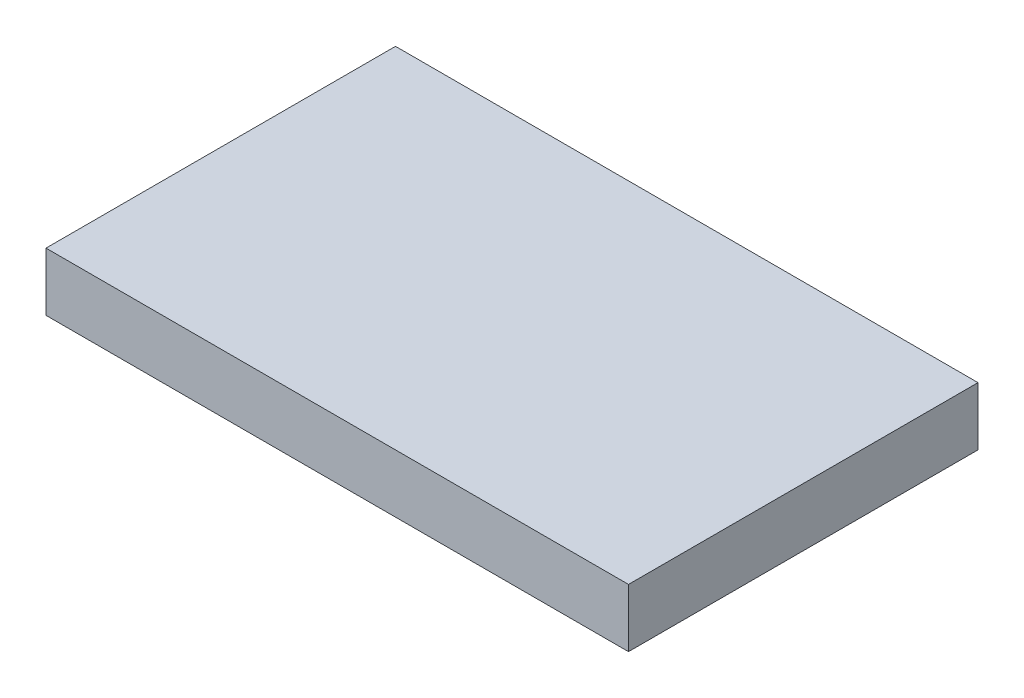
from build123d import *

# Parameters (mm, degrees)
SKETCH1_W           = 20
SKETCH1_H           = 12
BOSS_EXTRUDE2_DEPTH = 2


with BuildPart() as part:
    # Sketch1 → Boss-Extrude2 (new body)
    with BuildSketch(Plane(origin=(0, 0, 0), x_dir=(1, 0, 0), z_dir=(0, 1, 0))):
        with Locations((10, -6)):
            Rectangle(SKETCH1_W, SKETCH1_H)
    extrude(amount=BOSS_EXTRUDE2_DEPTH)


solid = part.part
